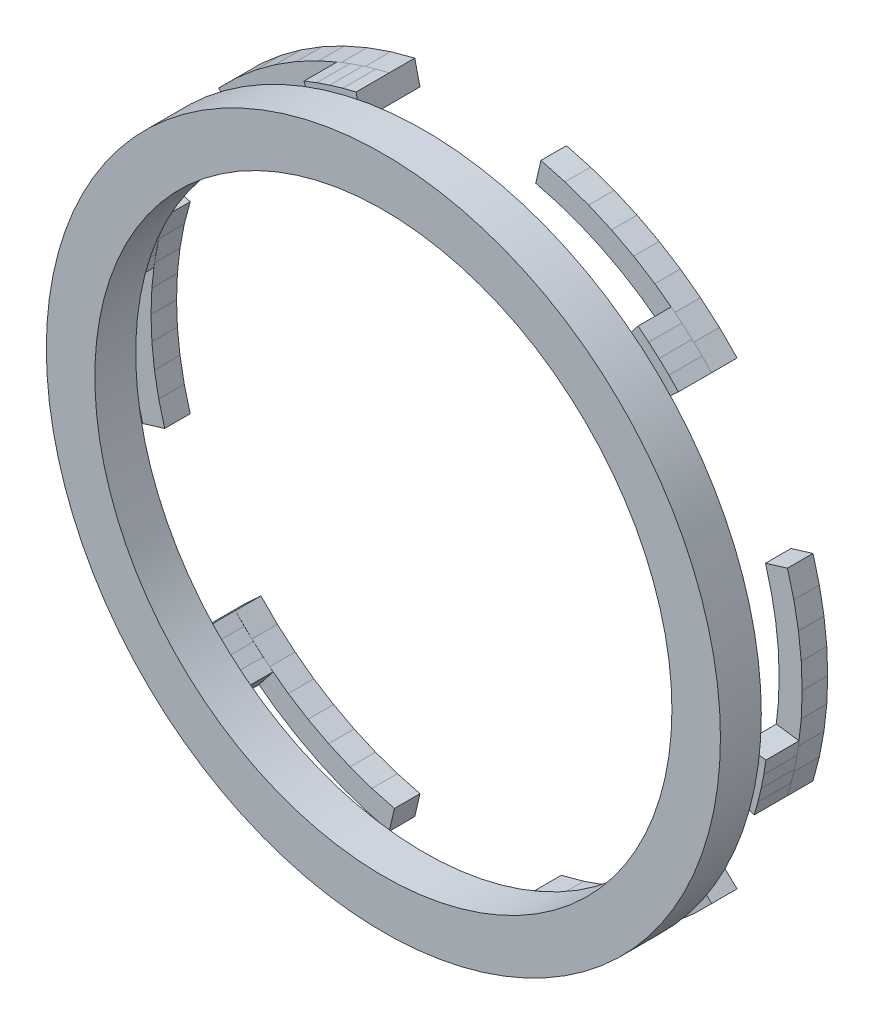
from build123d import *

# Parameters (mm, degrees)
EXTRUDE_START     = 13
SKETCH_1_R        = 66
SKETCH_1_R_2      = 56.5
EXTRUDE_1_DEPTH   = 8
EXTRUDE_2_DEPTH   = 5
EXTRUDE_2_2_DEPTH = 5
EXTRUDE_2_3_DEPTH = 5
EXTRUDE_2_4_DEPTH = 5
EXTRUDE_2_5_DEPTH = 5
EXTRUDE_2_6_DEPTH = 5
EXTRUDE_START_2   = 5
EXTRUDE_3_DEPTH   = 6.5


with BuildPart() as part:
    # 草圖1 → 填料-伸長1 (new body)
    with BuildSketch(Plane.XY.offset(EXTRUDE_START)):
        Circle(SKETCH_1_R)
        Circle(SKETCH_1_R_2, mode=Mode.SUBTRACT)
    extrude(amount=EXTRUDE_1_DEPTH)


with BuildPart() as body_2:
    # 草圖2 → 填料-伸長2 (new body)
    with BuildSketch(Plane.XY):
        Polygon((63.116113894, -19.296532512), (64.372593154, -14.566030711), (65.275046982, -9.755421135), (65.818512217, -4.891160353), (66, 0), (65.818512217, 4.891160353), (65.275046982, 9.755421135), (64.372593154, 14.566030711), (63.116113894, 19.296532512), (58.812742492, 17.98085984), (59.983552711, 13.572892254), (60.824475597, 9.090278784), (61.330886384, 4.557672147), (61.5, 0), (61.330886384, -4.557672147), (60.824475597, -9.090278784), (59.983552711, -13.572892254), (58.812742492, -17.98085984), align=None)
    extrude(amount=EXTRUDE_2_DEPTH)



with BuildPart() as body_3:
    # 草圖2 → Extrude 2 2 (new body)
    with BuildSketch(Plane.XY):
        Polygon((48.269344307, 45.011891764), (44.800849205, 48.465285623), (41.085966018, 51.652138352), (37.145125228, 54.554923442), (33, 57.15767665), (28.673386989, 59.446083795), (24.189080964, 61.407559487), (19.571743948, 63.031316334), (14.846769587, 64.308424276), (13.834489842, 59.923758984), (18.237306861, 58.733726584), (22.539825444, 57.220680431), (26.71838333, 55.392941718), (30.75, 53.260562333), (34.612503053, 50.835269571), (38.284650153, 48.130401646), (41.74624585, 45.16083433), (44.97825265, 41.942899144), align=None)
    extrude(amount=EXTRUDE_2_2_DEPTH)


with BuildPart() as body_4:
    # 草圖2 → Extrude 2 3 (new body)
    with BuildSketch(Plane.XY):
        Polygon((-14.846769587, 64.308424276), (-19.571743948, 63.031316334), (-24.189080964, 61.407559487), (-28.673386989, 59.446083795), (-33, 57.15767665), (-37.145125228, 54.554923442), (-41.085966018, 51.652138352), (-44.800849205, 48.465285623), (-48.269344307, 45.011891764), (-44.97825265, 41.942899144), (-41.74624585, 45.16083433), (-38.284650153, 48.130401646), (-34.612503053, 50.835269571), (-30.75, 53.260562333), (-26.71838333, 55.392941718), (-22.539825444, 57.220680431), (-18.237306861, 58.733726584), (-13.834489842, 59.923758984), align=None)
    extrude(amount=EXTRUDE_2_3_DEPTH)


with BuildPart() as body_5:
    # 草圖2 → Extrude 2 4 (new body)
    with BuildSketch(Plane.XY):
        Polygon((-63.116113894, 19.296532512), (-64.372593154, 14.566030711), (-65.275046982, 9.755421135), (-65.818512217, 4.891160353), (-66, 0), (-65.818512217, -4.891160353), (-65.275046982, -9.755421135), (-64.372593154, -14.566030711), (-63.116113894, -19.296532512), (-58.812742492, -17.98085984), (-59.983552711, -13.572892254), (-60.824475597, -9.090278784), (-61.330886384, -4.557672147), (-61.5, 0), (-61.330886384, 4.557672147), (-60.824475597, 9.090278784), (-59.983552711, 13.572892254), (-58.812742492, 17.98085984), align=None)
    extrude(amount=EXTRUDE_2_4_DEPTH)


with BuildPart() as body_6:
    # 草圖2 → Extrude 2 5 (new body)
    with BuildSketch(Plane.XY):
        Polygon((-48.269344307, -45.011891764), (-44.800849205, -48.465285623), (-41.085966018, -51.652138352), (-37.145125228, -54.554923442), (-33, -57.15767665), (-28.673386989, -59.446083795), (-24.189080964, -61.407559487), (-19.571743948, -63.031316334), (-14.846769587, -64.308424276), (-13.834489842, -59.923758984), (-18.237306861, -58.733726584), (-22.539825444, -57.220680431), (-26.71838333, -55.392941718), (-30.75, -53.260562333), (-34.612503053, -50.835269571), (-38.284650153, -48.130401646), (-41.74624585, -45.16083433), (-44.97825265, -41.942899144), align=None)
    extrude(amount=EXTRUDE_2_5_DEPTH)


with BuildPart() as body_7:
    # 草圖2 → Extrude 2 6 (new body)
    with BuildSketch(Plane.XY):
        Polygon((14.846769587, -64.308424276), (19.571743948, -63.031316334), (24.189080964, -61.407559487), (28.673386989, -59.446083795), (33, -57.15767665), (37.145125228, -54.554923442), (41.085966018, -51.652138352), (44.800849205, -48.465285623), (48.269344307, -45.011891764), (44.97825265, -41.942899144), (41.74624585, -45.16083433), (38.284650153, -48.130401646), (34.612503053, -50.835269571), (30.75, -53.260562333), (26.71838333, -55.392941718), (22.539825444, -57.220680431), (18.237306861, -58.733726584), (13.834489842, -59.923758984), align=None)
    extrude(amount=EXTRUDE_2_6_DEPTH)


with BuildPart() as body_2_1:
    add(body_2.part)

    add(body_3.part)  # 填料-伸長3 merges body 3

    add(body_4.part)  # 填料-伸長3 merges body 4

    add(body_5.part)  # 填料-伸長3 merges body 5

    add(body_6.part)  # 填料-伸長3 merges body 6

    add(body_7.part)  # 填料-伸長3 merges body 7
    # 草圖3 → 填料-伸長3 (add)
    with BuildSketch(Plane.XY.offset(EXTRUDE_START_2)):
        Polygon((63.116113894, -19.296532512), (63.84697331, -16.720167438), (64.472713691, -14.116273919), (64.992304803, -11.489139061), (65.404891181, -8.843088238), (60.945466782, -8.240150403), (60.561011294, -10.705788671), (60.076846848, -13.153800697), (59.493770584, -15.580156021), (58.812742492, -17.98085984), align=None)
        Polygon((48.269344307, 45.011891764), (46.403576412, 46.933017122), (44.461408666, 48.776870948), (42.446038696, 50.540417479), (40.360784652, 52.220753176), (37.608912971, 48.660247278), (39.551990603, 47.094479924), (41.429948984, 45.451175201), (43.239696202, 43.733038682), (44.97825265, 41.942899144), align=None)
        Polygon((-14.846769587, 64.308424276), (-17.443396899, 63.65318456), (-20.011305025, 62.893144866), (-22.546266107, 62.029556541), (-25.044106529, 61.063841413), (-23.336553811, 56.900397681), (-21.00902069, 57.800268595), (-18.646897864, 58.604975898), (-16.254074383, 59.313194704), (-13.834489842, 59.923758984), align=None)
        Polygon((-63.116113894, 19.296532512), (-63.84697331, 16.720167438), (-64.472713691, 14.116273919), (-64.992304803, 11.489139061), (-65.404891181, 8.843088238), (-60.945466782, 8.240150403), (-60.561011294, 10.705788671), (-60.076846848, 13.153800697), (-59.493770584, 15.580156021), (-58.812742492, 17.98085984), align=None)
        Polygon((-48.269344307, -45.011891764), (-46.403576412, -46.933017122), (-44.461408666, -48.776870948), (-42.446038696, -50.540417479), (-40.360784652, -52.220753176), (-37.608912971, -48.660247278), (-39.551990603, -47.094479924), (-41.429948984, -45.451175201), (-43.239696202, -43.733038682), (-44.97825265, -41.942899144), align=None)
        Polygon((14.846769587, -64.308424276), (17.443396899, -63.65318456), (20.011305025, -62.893144866), (22.546266107, -62.029556541), (25.044106529, -61.063841413), (23.336553811, -56.900397681), (21.00902069, -57.800268595), (18.646897864, -58.604975898), (16.254074383, -59.313194704), (13.834489842, -59.923758984), align=None)
    extrude(amount=EXTRUDE_3_DEPTH)


solid = Compound([part.part, body_2_1.part])
